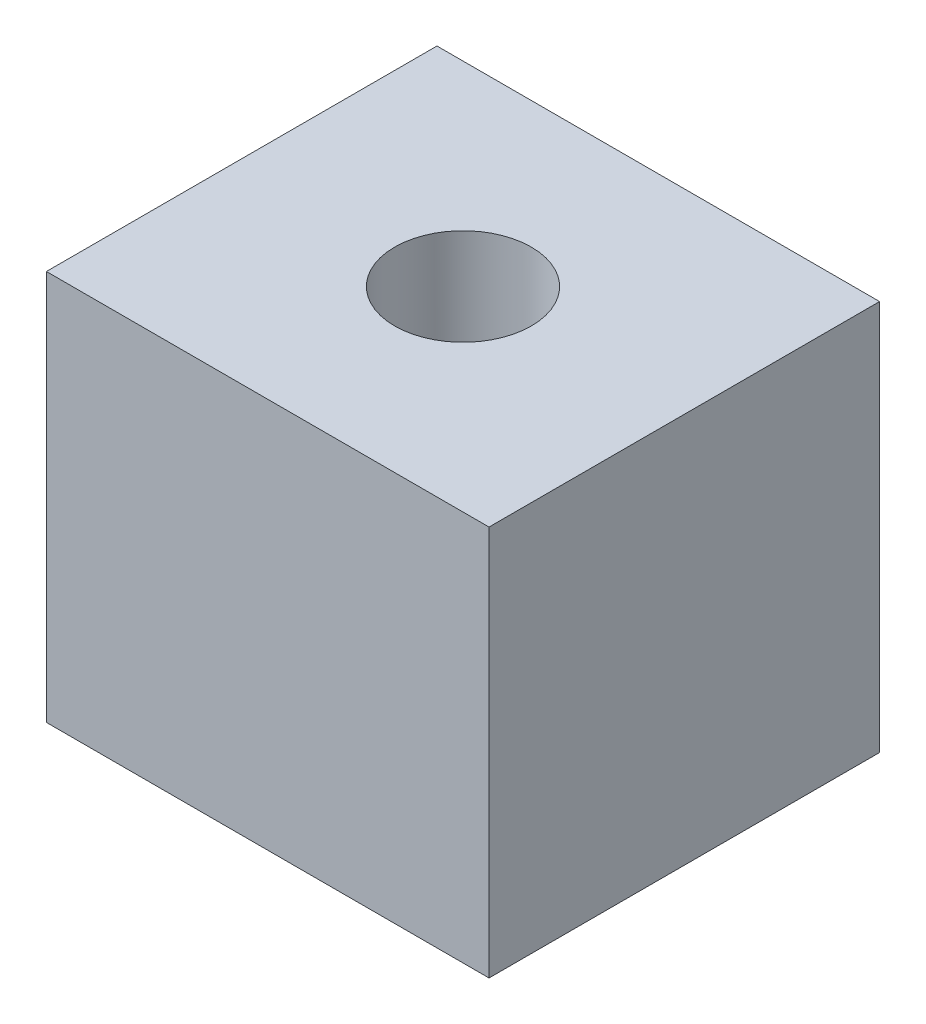
from build123d import *

# Parameters (mm, degrees)
SKETCH_1_W               = 34
SKETCH_1_H               = 30
EXTRUDE_1_DEPTH          = 30
CUT_EXTRUDE_1_DEPTH      = 55.369108876
CUT_EXTRUDE_1_DEPTH_BACK = 55.369108876
SKETCH_2_R               = 5.25
SKETCH_3_R               = 1.7
CUT_EXTRUDE_2_DEPTH      = 4


with BuildPart() as part:
    # 草图1 → 凸台-拉伸1 (new body)
    with BuildSketch(Plane.XY):
        with Locations((17, 15)):
            Rectangle(SKETCH_1_W, SKETCH_1_H)
    extrude(amount=EXTRUDE_1_DEPTH)

    # 草图2 → 切除-拉伸1 (cut, two sides: drawn at the far end of the back side and taken through both)
    with BuildSketch(Plane(origin=(0, 30, 0), x_dir=(1, 0, 0), z_dir=(0, 1, 0)).offset(-CUT_EXTRUDE_1_DEPTH_BACK)):
        with Locations(Location((17, -15, 0), (0, 0, 270))):
            Circle(SKETCH_2_R)
    extrude(amount=CUT_EXTRUDE_1_DEPTH + CUT_EXTRUDE_1_DEPTH_BACK, mode=Mode.SUBTRACT)

    # 草图3 → 切除-拉伸2 (cut)
    with BuildSketch(Plane(origin=(0, 0, 0), x_dir=(-1, 0, 0), z_dir=(0, 0, -1))):
        with Locations((-29, 25)):
            Circle(SKETCH_3_R)
        with Locations(Location((-29, 5, 0), (0, 0, 180))):
            Circle(SKETCH_3_R)
        with Locations((-5, 5)):
            Circle(SKETCH_3_R)
        with Locations(Location((-5, 25, 0), (0, 0, 180))):
            Circle(SKETCH_3_R)
    extrude(amount=-CUT_EXTRUDE_2_DEPTH, mode=Mode.SUBTRACT)


solid = part.part
